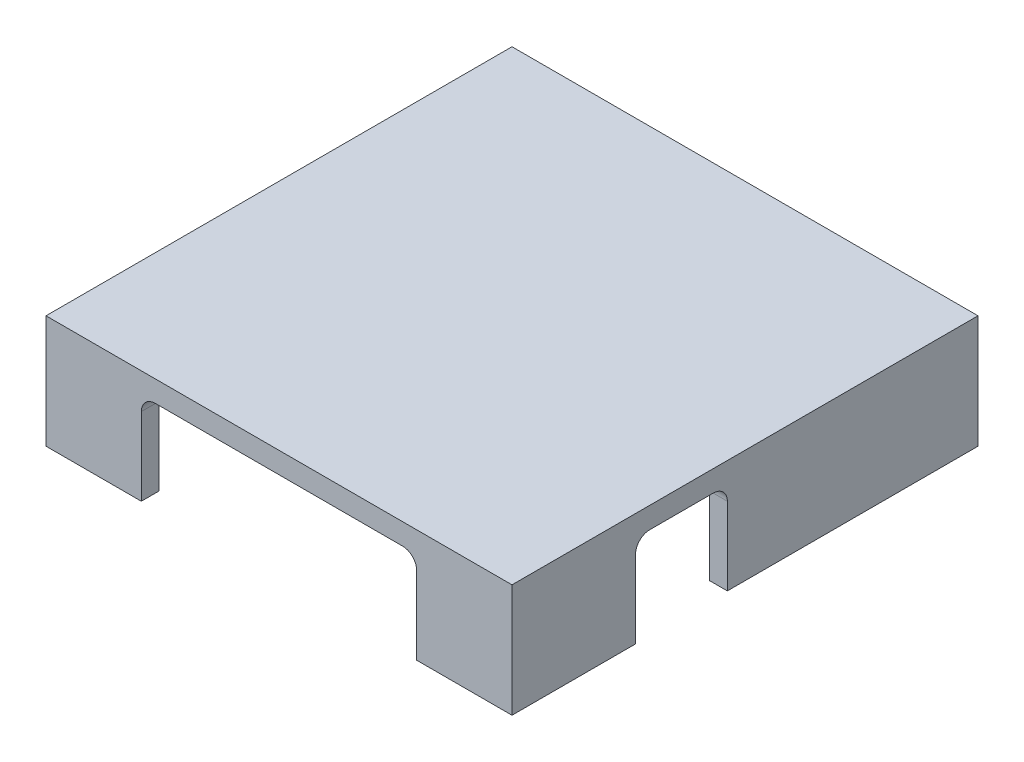
from build123d import *

# Parameters (mm, degrees)
SKETCH1_W           = 66
SKETCH1_H           = 66
BOSS_EXTRUDE1_DEPTH = 3
SKETCH2_W           = 11
SKETCH2_H           = 2.5
BOSS_EXTRUDE3_DEPTH = 13
SKETCH5_W           = 10
SKETCH5_H           = 1.5
BOSS_EXTRUDE4_DEPTH = 1.5
FILLET2_R           = 1
SKETCH6_W           = 10
SKETCH6_H           = 1.5
BOSS_EXTRUDE5_DEPTH = 1.5
FILLET3_R           = 1
FILLET4_R           = 2


with BuildPart() as part:
    # Sketch1 → Boss-Extrude1 (new body)
    with BuildSketch(Plane(origin=(0, 0, 0), x_dir=(1, 0, 0), z_dir=(0, 1, 0))):
        Rectangle(SKETCH1_W, SKETCH1_H)
    extrude(amount=BOSS_EXTRUDE1_DEPTH)

    # Sketch2 → Boss-Extrude3 (add)
    with BuildSketch(Plane(origin=(0, 0, 0), x_dir=(1, 0, 0), z_dir=(0, 1, 0))):
        Polygon((-30.5, 30.5), (-14.5, 30.5), (-14.5, 33), (-33, 33), (-33, 9.5), (-30.5, 9.5), align=None)
        Polygon((-30.5, -30.5), (-19.5, -30.5), (-19.5, -33), (-33, -33), (-33, -18.5), (-30.5, -18.5), align=None)
        Polygon((30.5, 30.5), (30.5, -2.5), (33, -2.5), (33, 33), (16.5, 33), (16.5, 30.5), align=None)
        with Locations((1, 31.75)):
            Rectangle(SKETCH2_W, SKETCH2_H)
        Polygon((30.5, -15.5), (33, -15.5), (33, -33), (19.5, -33), (19.5, -30.5), (30.5, -30.5), align=None)
    extrude(amount=-BOSS_EXTRUDE3_DEPTH)

    # Sketch5 → Boss-Extrude4 (add)
    with BuildSketch(Plane.ZY.offset(-30.5)):
        with Locations((-9.5, -12.25)):
            Rectangle(SKETCH5_W, SKETCH5_H)
    extrude(amount=BOSS_EXTRUDE4_DEPTH)

    # Fillet2
    fillet2_edges = [part.edges().sort_by_distance(p)[0] for p in [
        (29, -13, -9.5),
    ]]
    fillet(fillet2_edges, radius=FILLET2_R)

    # Sketch6 → Boss-Extrude5 (add)
    with BuildSketch(Plane(origin=(-30.5, 0, 0), x_dir=(0, 0, -1), z_dir=(1, 0, 0))):
        with Locations((17.5, -12.25)):
            Rectangle(SKETCH6_W, SKETCH6_H)
    extrude(amount=BOSS_EXTRUDE5_DEPTH)

    # Fillet3
    fillet3_edges = [part.edges().sort_by_distance(p)[0] for p in [
        (-29, -13, -17.5),
    ]]
    fillet(fillet3_edges, radius=FILLET3_R)

    # Fillet4
    fillet4_edges = [part.edges().sort_by_distance(p)[0] for p in [
        (31.75, 0, 15.5),
        (-31.75, 0, 18.5),
        (19.5, 0, 31.75),
        (-4.5, 0, -31.75),
        (31.75, 0, 2.5),
        (-19.5, 0, 31.75),
        (-31.75, 0, -9.5),
        (-14.5, 0, -31.75),
        (6.5, 0, -31.75),
        (16.5, 0, -31.75),
        (25, 0, 30.5),
        (-25, 0, 30.5),
        (-30.5, 0, 24.5),
        (30.5, 0, 23),
        (30.5, 0, -14),
        (23.5, 0, -30.5),
        (1, 0, -30.5),
        (-22.5, 0, -30.5),
        (-30.5, 0, -20),
    ]]
    fillet(fillet4_edges, radius=FILLET4_R)


solid = part.part
